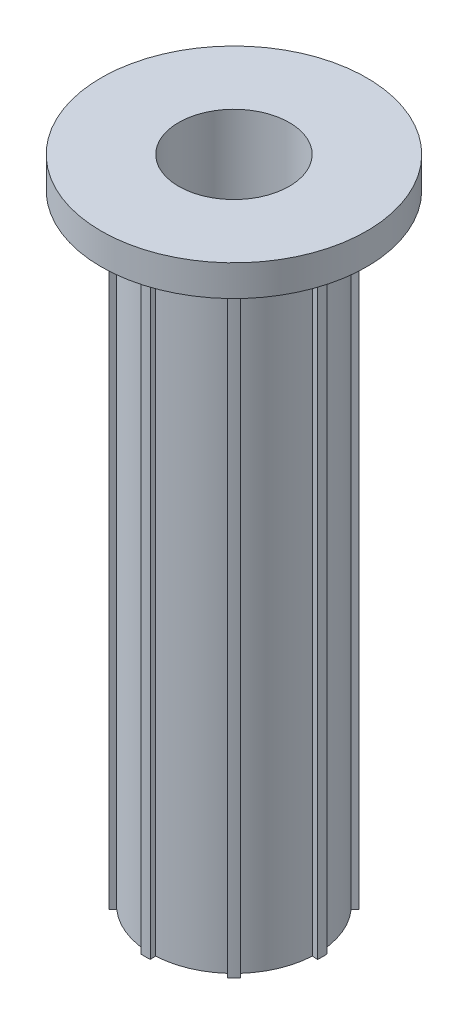
from build123d import *

# Parameters (mm, degrees)
SKETCH2_R           = 5.08
BOSS_EXTRUDE1_DEPTH = 35.56
SKETCH4_R           = 7.62
BOSS_EXTRUDE2_DEPTH = 1.778
SKETCH5_R           = 3.175
CUT_EXTRUDE2_DEPTH  = 39.862
CUT_EXTRUDE3_DEPTH  = 35.56


with BuildPart() as part:
    # Sketch2 → Boss-Extrude1 (new body)
    with BuildSketch(Plane(origin=(0, 0, 0), x_dir=(1, 0, 0), z_dir=(0, 1, 0))):
        with Locations(Location((0, 0, 0), (0, 0, 270))):
            Circle(SKETCH2_R)
    extrude(amount=BOSS_EXTRUDE1_DEPTH)

    # Sketch4 → Boss-Extrude2 (add)
    with BuildSketch(Plane(origin=(0, 35.56, 0), x_dir=(1, 0, 0), z_dir=(0, 1, 0))):
        with Locations(Location((0, 0, 0), (0, 0, 270))):
            Circle(SKETCH4_R)
    extrude(amount=BOSS_EXTRUDE2_DEPTH)

    # Sketch5 → Cut-Extrude2 (cut, through all)
    with BuildSketch(Plane(origin=(0, 37.338, 0), x_dir=(1, 0, 0), z_dir=(0, 1, 0))):
        with Locations(Location((0, 0, 0), (0, 0, 270))):
            Circle(SKETCH5_R)
    extrude(amount=-CUT_EXTRUDE2_DEPTH, mode=Mode.SUBTRACT)

    # Sketch6 → Cut-Extrude3 (cut)
    with BuildSketch(Plane.XZ):
        with BuildLine():
            Line((-3.77856884, 3.395411245), (-3.542408287, 3.183198042))
            ThreePointArc((-3.542408287, 3.183198042), (-4.399976274, 1.822529847), (-4.755721843, 0.254))
            Line((-4.755721843, 0.254), (-5.072769966, 0.270933333))
            ThreePointArc((-5.072769966, 0.270933333), (-4.693308025, 1.944031836), (-3.77856884, 3.395411245))
        make_face()
        with BuildLine():
            Line((-0.270933333, 5.072769966), (-0.254, 4.755721843))
            ThreePointArc((-0.254, 4.755721843), (-1.822529847, 4.399976274), (-3.183198042, 3.542408287))
            Line((-3.183198042, 3.542408287), (-3.395411245, 3.77856884))
            ThreePointArc((-3.395411245, 3.77856884), (-1.944031836, 4.693308025), (-0.270933333, 5.072769966))
        make_face()
        with BuildLine():
            Line((0.270933333, 5.072769966), (0.254, 4.755721843))
            ThreePointArc((0.254, 4.755721843), (1.822529847, 4.399976274), (3.183198042, 3.542408287))
            Line((3.183198042, 3.542408287), (3.395411245, 3.77856884))
            ThreePointArc((3.395411245, 3.77856884), (1.944031836, 4.693308025), (0.270933333, 5.072769966))
        make_face()
        with BuildLine():
            Line((3.77856884, 3.395411245), (3.542408287, 3.183198042))
            ThreePointArc((3.542408287, 3.183198042), (4.399976274, 1.822529847), (4.755721843, 0.254))
            Line((4.755721843, 0.254), (5.072769966, 0.270933333))
            ThreePointArc((5.072769966, 0.270933333), (4.693308025, 1.944031836), (3.77856884, 3.395411245))
        make_face()
        with BuildLine():
            Line((5.072769966, -0.270933333), (4.755721843, -0.254))
            ThreePointArc((4.755721843, -0.254), (4.399976274, -1.822529847), (3.542408287, -3.183198042))
            Line((3.542408287, -3.183198042), (3.77856884, -3.395411245))
            ThreePointArc((3.77856884, -3.395411245), (4.693308025, -1.944031836), (5.072769966, -0.270933333))
        make_face()
        with BuildLine():
            Line((3.183198042, -3.542408287), (3.395411245, -3.77856884))
            ThreePointArc((3.395411245, -3.77856884), (1.944031836, -4.693308025), (0.270933333, -5.072769966))
            Line((0.270933333, -5.072769966), (0.254, -4.755721843))
            ThreePointArc((0.254, -4.755721843), (1.822529847, -4.399976274), (3.183198042, -3.542408287))
        make_face()
        with BuildLine():
            Line((-4.755721843, -0.254), (-5.072769966, -0.270933333))
            ThreePointArc((-5.072769966, -0.270933333), (-4.693308025, -1.944031836), (-3.77856884, -3.395411245))
            Line((-3.77856884, -3.395411245), (-3.542408287, -3.183198042))
            ThreePointArc((-3.542408287, -3.183198042), (-4.399976274, -1.822529847), (-4.755721843, -0.254))
        make_face()
        with BuildLine():
            Line((-3.183198042, -3.542408287), (-3.395411245, -3.77856884))
            ThreePointArc((-3.395411245, -3.77856884), (-1.944031836, -4.693308025), (-0.270933333, -5.072769966))
            Line((-0.270933333, -5.072769966), (-0.254, -4.755721843))
            ThreePointArc((-0.254, -4.755721843), (-1.822529847, -4.399976274), (-3.183198042, -3.542408287))
        make_face()
    extrude(amount=-CUT_EXTRUDE3_DEPTH, mode=Mode.SUBTRACT)


solid = part.part
